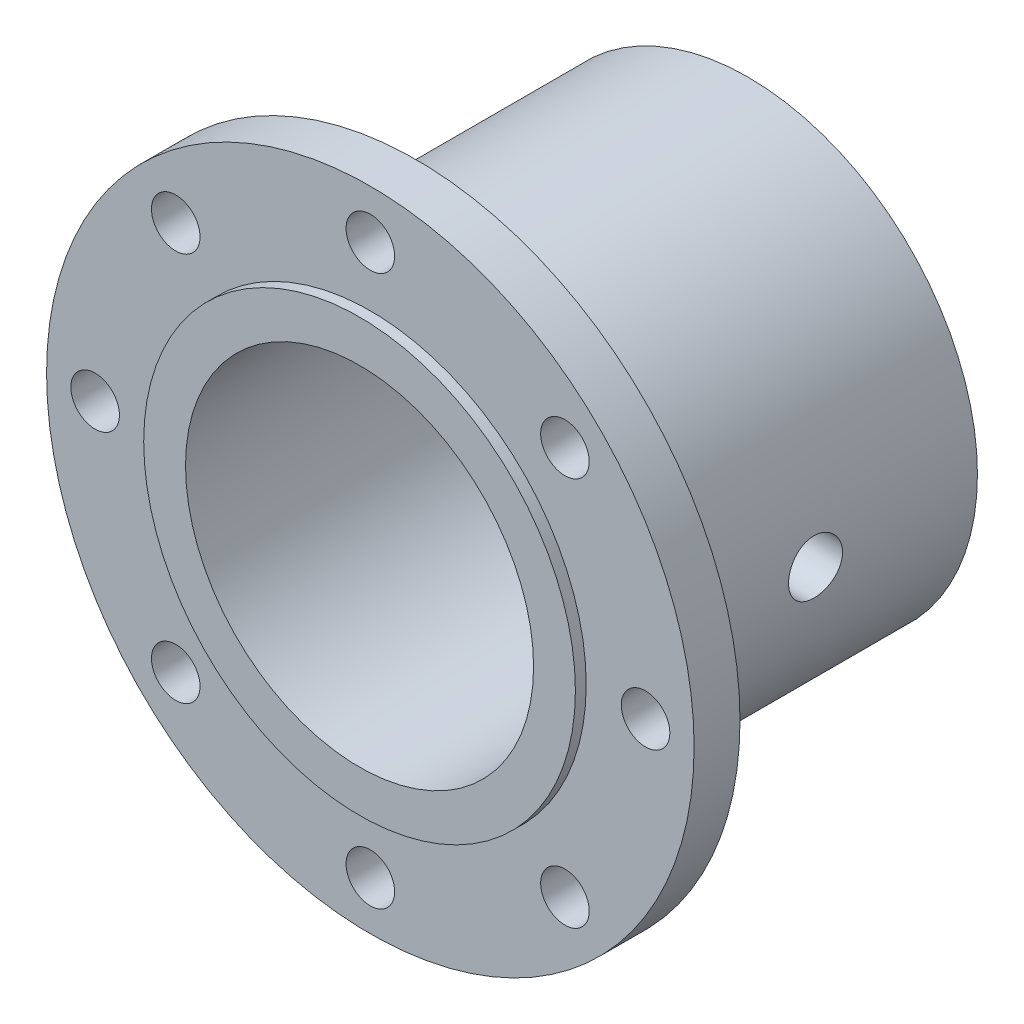
from build123d import *

# Parameters (mm, degrees)
SKETCH2_R          = 4.5
CUT_EXTRUDE1_DEPTH = 127.479115352
CIRPATTERN1_COUNT  = 8
SKETCH3_R          = 5
CUT_EXTRUDE2_DEPTH = 70


with BuildPart() as part:
    # Sketch1 → Revolve1 (revolve)
    with BuildSketch(Plane(origin=(0, 0, 0), x_dir=(0, 0, -1), z_dir=(1, 0, 0)), mode=Mode.PRIVATE) as revolve1_sk:
        Polygon((-9.502538071, 5.664974619), (-81.502538071, 5.664974619), (-81.502538071, 13.414974619), (-79.502538071, 13.414974619), (-79.502538071, 33.414974619), (-71.002538071, 33.414974619), (-71.002538071, 15.914974619), (-9.502538071, 15.914974619), align=None)
    revolve(revolve1_sk.sketch.rotate(Axis((0, -26.585025381, 81.502538071), (0, 0, -1)), 90), axis=Axis((0, -26.585025381, 81.502538071), (0, 0, -1)))

    # Sketch2 → Cut-Extrude1 (cut, symmetric)
    with BuildSketch(Plane.XY.offset(79.502538071)):
        with Locations((51, -26.585025381)):
            Circle(SKETCH2_R)
    cut_extrude1 = extrude(amount=CUT_EXTRUDE1_DEPTH, both=True, mode=Mode.SUBTRACT)

    # CirPattern1: Cut-Extrude1 ×8 about axis
    cirpattern1_axis = Axis((0, -26.585025381, 0), (0, 0, 1))
    for i in range(1, CIRPATTERN1_COUNT):
        add(cut_extrude1.rotate(cirpattern1_axis, i * 360 / CIRPATTERN1_COUNT), mode=Mode.SUBTRACT)

    # Sketch3 → Cut-Extrude2 (cut)
    with BuildSketch(Plane(origin=(0, 0, 0), x_dir=(0, 0, -1), z_dir=(1, 0, 0))):
        with Locations(Location((-39.502538071, -26.585025381, 0), (0, 0, 180))):
            Circle(SKETCH3_R)
    extrude(amount=CUT_EXTRUDE2_DEPTH, mode=Mode.SUBTRACT)


solid = part.part
